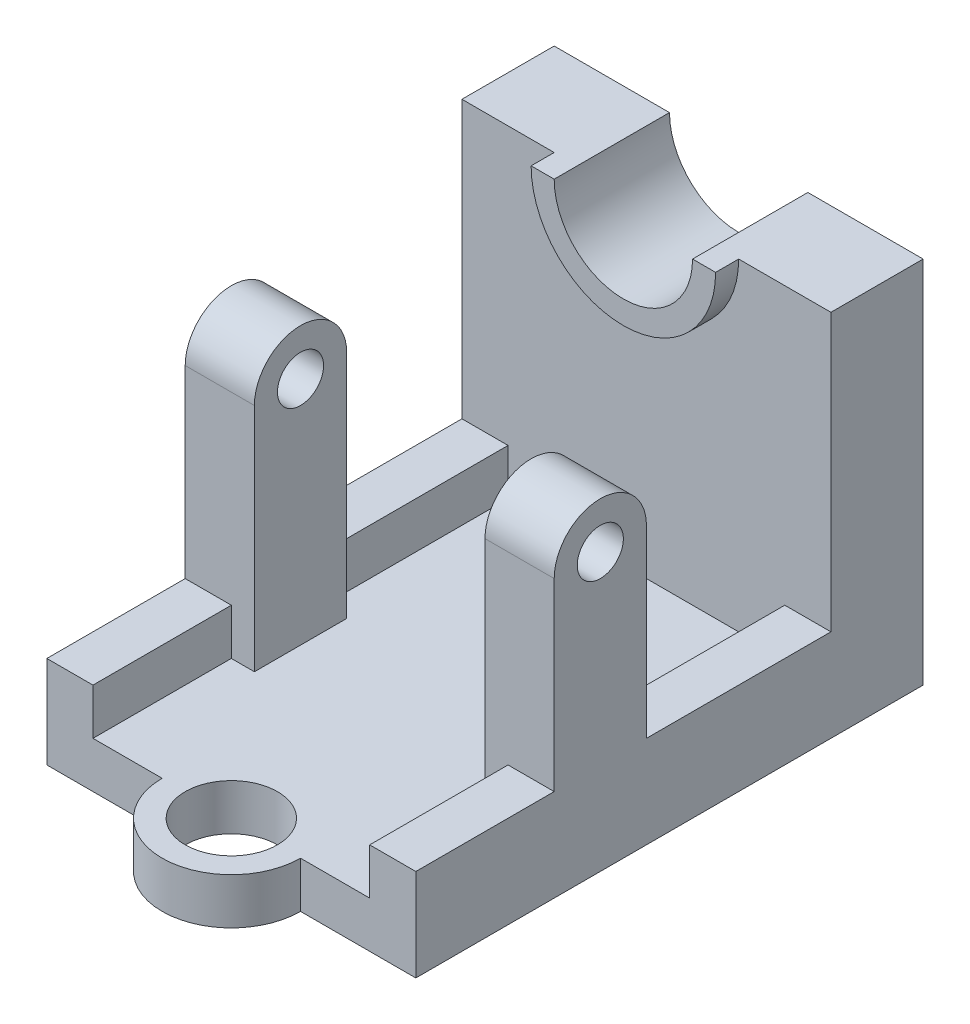
from build123d import *

# Parameters (mm, degrees)
BOSS_EXTRUDE1_DEPTH = 110
SKETCH2_W           = 80
SKETCH2_H           = 80
BOSS_EXTRUDE2_DEPTH = 20
SKETCH3_R           = 15
CUT_EXTRUDE1_DEPTH  = 20
BOSS_EXTRUDE3_START = 5
BOSS_EXTRUDE3_DEPTH = 5
BOSS_EXTRUDE4_DEPTH = 10
HOLE1_D             = 20
SKETCH9_R           = 5
BOSS_EXTRUDE5_DEPTH = 15
LPATTERN1_COUNT     = 2
LPATTERN1_PITCH     = 65


with BuildPart() as part:
    # Sketch1 → Boss-Extrude1 (new body)
    with BuildSketch(Plane.XY):
        Polygon((-40, 20), (-40, 0), (40, 0), (40, 20), (30, 20), (30, 10), (-30, 10), (-30, 20), align=None)
    extrude(amount=BOSS_EXTRUDE1_DEPTH)

    # Sketch2 → Boss-Extrude2 (add)
    with BuildSketch(Plane(origin=(0, 0, 0), x_dir=(-1, 0, 0), z_dir=(0, 0, -1))):
        with Locations((0, 40)):
            Rectangle(SKETCH2_W, SKETCH2_H)
    extrude(amount=-BOSS_EXTRUDE2_DEPTH)

    # Sketch3 → Cut-Extrude1 (cut)
    with BuildSketch(Plane.XY.offset(20)):
        with Locations((0, 80)):
            Circle(SKETCH3_R)
    extrude(amount=-CUT_EXTRUDE1_DEPTH, mode=Mode.SUBTRACT)

    # Sketch4 → Boss-Extrude3 (add)
    with BuildSketch(Plane.XY.offset(20).offset(BOSS_EXTRUDE3_START)):
        with BuildLine():
            Line((-20, 80), (-15, 80))
            ThreePointArc((-15, 80), (0, 65), (15, 80))
            Line((15, 80), (20, 80))
            ThreePointArc((20, 80), (0, 60), (-20, 80))
        make_face()
    extrude(amount=-BOSS_EXTRUDE3_DEPTH)

    # Sketch6 → Boss-Extrude4 (add)
    with BuildSketch(Plane(origin=(0, 10, 0), x_dir=(1, 0, 0), z_dir=(0, 1, 0))):
        with BuildLine():
            Line((-15, -110), (15, -110))
            ThreePointArc((15, -110), (0, -125), (-15, -110))
        make_face()
    extrude(amount=-BOSS_EXTRUDE4_DEPTH)

    # Hole1 (through all)
    with Locations(Plane(origin=(0, 10, 0), x_dir=(1, 0, 0), z_dir=(0, 1, 0))):
        with Locations((0, -110)):
            Hole(HOLE1_D / 2)

    # Sketch9 → Boss-Extrude5 (add)
    with BuildSketch(Plane(origin=(40, 0, 0), x_dir=(0, 0, -1), z_dir=(1, 0, 0))):
        with BuildLine():
            Line((-80, 60), (-80, 0))
            Line((-80, 0), (-60, 0))
            Line((-60, 0), (-60, 60))
            ThreePointArc((-60, 60), (-70, 70), (-80, 60))
        make_face()
        with Locations((-70, 60)):
            Circle(SKETCH9_R, mode=Mode.SUBTRACT)
    boss_extrude5 = extrude(amount=-BOSS_EXTRUDE5_DEPTH)

    # LPattern1: Boss-Extrude5 ×2
    with Locations(*[(-i * LPATTERN1_PITCH, 0, 0) for i in range(1, LPATTERN1_COUNT)]):
        add(boss_extrude5)


solid = part.part
